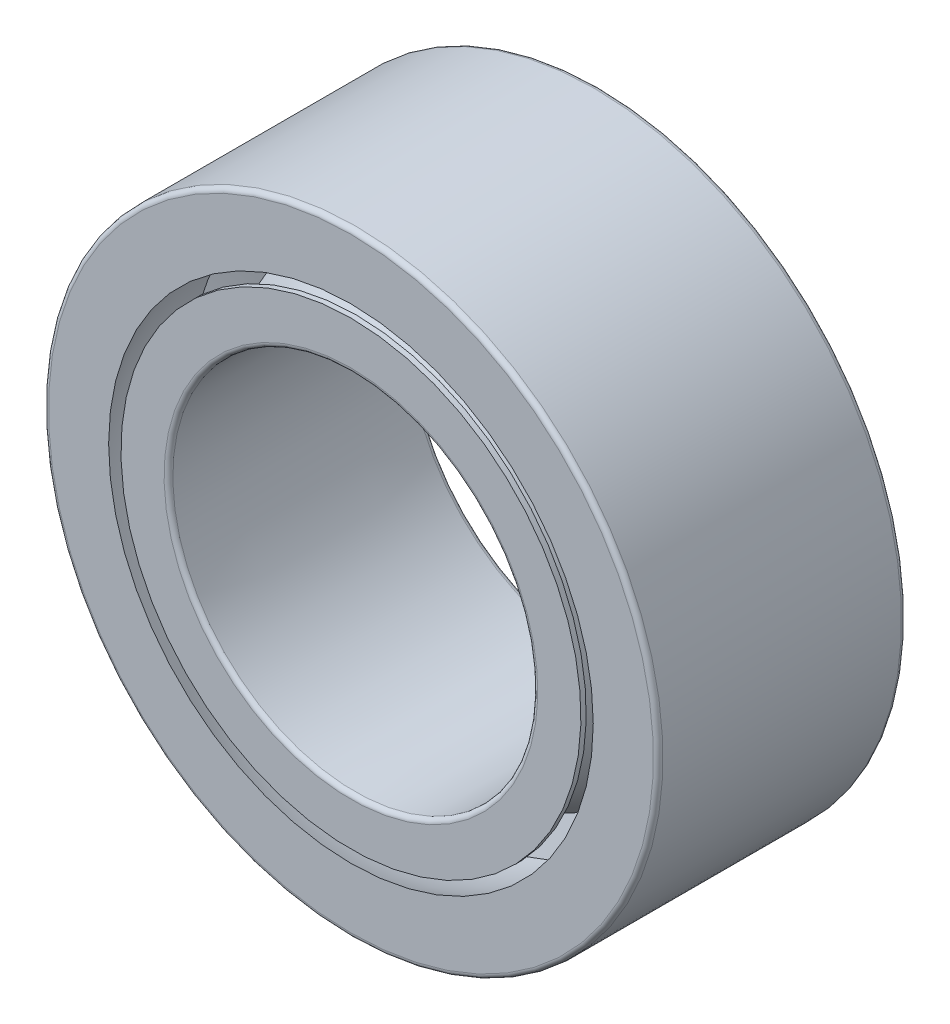
from build123d import *

# Parameters (mm, degrees)
SCALE1_SCALE = 0.1


with BuildPart() as part:
    # Sketch1 → Revolve1 (revolve)
    with BuildSketch(Plane(origin=(0, 0, 0), x_dir=(0, 0, -1), z_dir=(1, 0, 0))):
        with BuildLine():
            Line((-109, 132.9), (-109, 106.46083787))
            ThreePointArc((-109, 106.46083787), (-54.5, 119.6), (0, 106.46083787))
            Line((0, 106.46083787), (0, 132.9))
            ThreePointArc((0, 132.9), (-0.61507576, 134.38492424), (-2.1, 135))
            Line((-2.1, 135), (-106.9, 135))
            ThreePointArc((-106.9, 135), (-108.38492424, 134.38492424), (-109, 132.9))
        make_face()
        with BuildLine():
            Line((-107.227020476, 80.025618741), (-2.129491279, 81.544229828))
            ThreePointArc((-2.129491279, 81.544229828), (-0.666754601, 82.167284715), (-0.05984455, 83.636793536))
            Line((-0.05984455, 83.636793536), (0, 101.05))
            Line((0, 101.05), (-2.341831697, 101.05))
            Line((-2.341831697, 101.05), (-6.566111867, 87.065456039))
            ThreePointArc((-6.566111867, 87.065456039), (-26.913814114, 91.324489313), (-46.216639617, 99.042602992))
            Line((-46.216639617, 99.042602992), (-41.992359447, 113.027146954))
            Line((-41.992359447, 113.027146954), (-67.007640553, 113.027146954))
            Line((-67.007640553, 113.027146954), (-62.783360383, 99.042602992))
            ThreePointArc((-62.783360383, 99.042602992), (-82.086185886, 91.324489313), (-102.433888133, 87.065456039))
            Line((-102.433888133, 87.065456039), (-106.658168303, 101.05))
            Line((-106.658168303, 101.05), (-109, 101.05))
            Line((-109, 101.05), (-109, 82.1))
            ThreePointArc((-109, 82.1), (-108.496361958, 80.735584924), (-107.227020476, 80.025618741))
        make_face()
    revolve(axis=Axis((0, 0, 0), (0, 0, 1)))


with BuildPart() as part_1:
    # Scale1: scaled about (0, 0, 0)
    add(part.part.scale(SCALE1_SCALE))


solid = part_1.part
